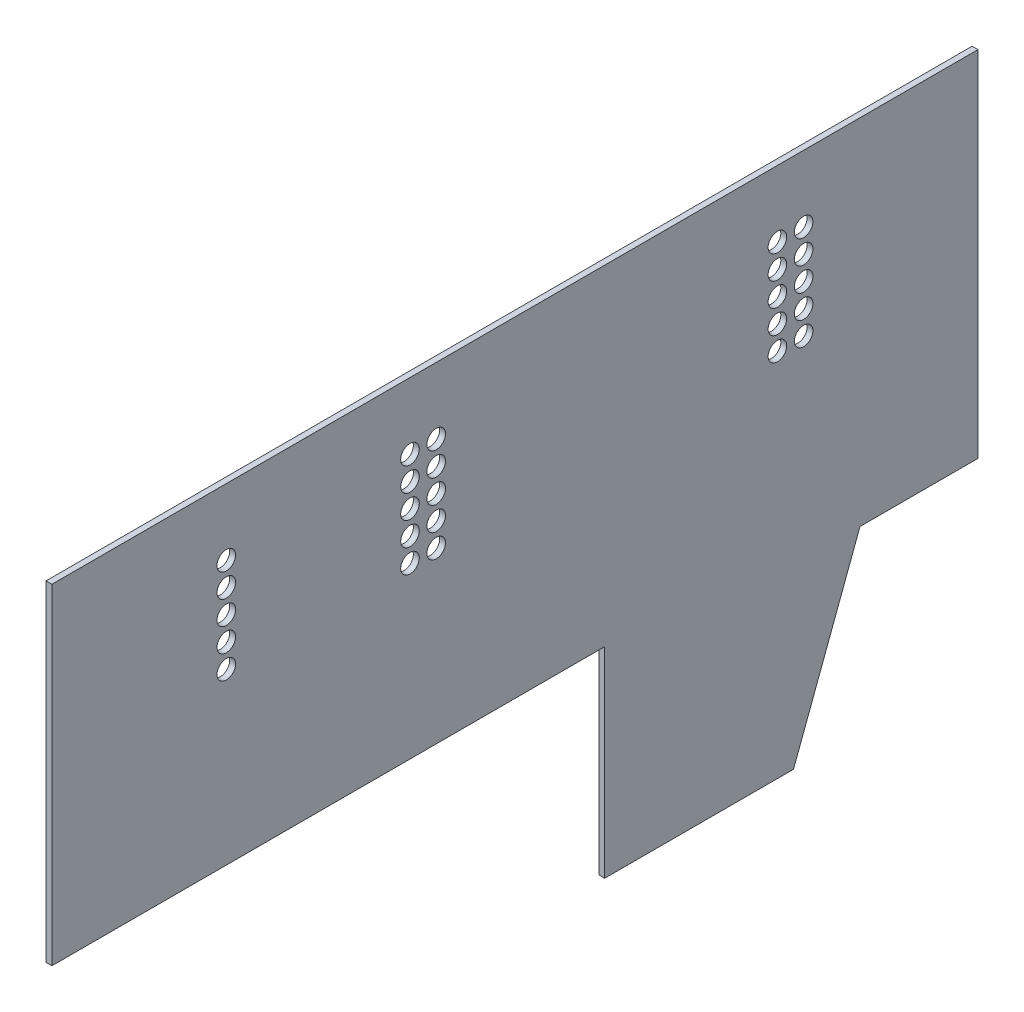
from build123d import *

# Parameters (mm, degrees)
SKETCH1_W                 = 498.348
SKETCH1_H                 = 177.8
BOSS_EXTRUDE1_DEPTH       = 1.5875
BOSS_EXTRUDE2_DEPTH       = 3.175
SKETCH3_R                 = 5
CUT_EXTRUDE1_DEPTH        = 318.565245896
LPATTERN3_COUNT           = 3
LPATTERN3_PITCH           = 12.7
LPATTERN3_COL_COUNT       = 3
LPATTERN3_COL_PITCH       = 12.7
LPATTERN1_COUNT           = 2
LPATTERN1_PITCH           = 197.7136
LPATTERN1_COPY_1_SKETCH_R = 5
LPATTERN1_COPY_1_DEPTH    = 318.565245896
LPATTERN1_COPY_2_SKETCH_R = 5
LPATTERN1_COPY_2_DEPTH    = 318.565245896
LPATTERN1_COPY_3_SKETCH_R = 5
LPATTERN1_COPY_3_DEPTH    = 318.565245896
LPATTERN1_COPY_4_SKETCH_R = 5
LPATTERN1_COPY_4_DEPTH    = 318.565245896
SKETCH4_R                 = 5
CUT_EXTRUDE2_DEPTH        = 318.565245896
LPATTERN4_COUNT           = 3
LPATTERN4_PITCH           = 12.7
LPATTERN4_COL_COUNT       = 3
LPATTERN4_COL_PITCH       = 12.7
LPATTERN5_COUNT           = 4
LPATTERN5_PITCH           = 98.8568
LPATTERN5_COPY_1_SKETCH_R = 5
LPATTERN5_COPY_1_DEPTH    = 318.565245896
LPATTERN5_COPY_2_SKETCH_R = 5
LPATTERN5_COPY_2_DEPTH    = 318.565245896
LPATTERN5_COPY_3_SKETCH_R = 5
LPATTERN5_COPY_3_DEPTH    = 318.565245896
LPATTERN5_COPY_4_SKETCH_R = 5
LPATTERN5_COPY_4_DEPTH    = 318.565245896
LPATTERN5_COPY_5_SKETCH_R = 5
LPATTERN5_COPY_5_DEPTH    = 318.565245896
LPATTERN5_COPY_6_SKETCH_R = 5
LPATTERN5_COPY_6_DEPTH    = 318.565245896
LPATTERN5_COPY_7_SKETCH_R = 5
LPATTERN5_COPY_7_DEPTH    = 318.565245896
LPATTERN5_COPY_8_SKETCH_R = 5
LPATTERN5_COPY_8_DEPTH    = 318.565245896


with BuildPart() as part:
    # Sketch1 → Boss-Extrude1 (new, symmetric)
    with BuildSketch(Plane(origin=(0, 0, 0), x_dir=(0, 0, -1), z_dir=(1, 0, 0))):
        Rectangle(SKETCH1_W, SKETCH1_H)
    extrude(amount=BOSS_EXTRUDE1_DEPTH, both=True)

    # Sketch2 → Boss-Extrude2 (add)
    with BuildSketch(Plane(origin=(1.5875, 0, 0), x_dir=(0, 0, -1), z_dir=(1, 0, 0))):
        Polygon((249.174, -88.9), (48.2854, -88.9), (48.2854, -196.85), (149.8854, -196.85), (185.674, -101.6), (249.174, -101.6), align=None)
    extrude(amount=-BOSS_EXTRUDE2_DEPTH)

    # Sketch3 → Cut-Extrude1 (cut, through all)
    with BuildSketch(Plane(origin=(1.5875, 0, 0), x_dir=(0, 0, -1), z_dir=(1, 0, 0))):
        with Locations((155.3337, 27.7749)):
            Circle(SKETCH3_R)
    cut_extrude1 = extrude(amount=-CUT_EXTRUDE1_DEPTH, mode=Mode.SUBTRACT)

    # LPattern3: Cut-Extrude1 ×3
    with Locations(*[(0, i * LPATTERN3_PITCH, 0) for i in range(1, LPATTERN3_COUNT)]):
        add(cut_extrude1, mode=Mode.SUBTRACT)

    # LPattern3 col: Cut-Extrude1 ×3
    with Locations(*[(0, -i * LPATTERN3_COL_PITCH, 0) for i in range(1, LPATTERN3_COL_COUNT)]):
        add(cut_extrude1, mode=Mode.SUBTRACT)

    # LPattern1: Cut-Extrude1 ×2
    with Locations(*[(0, 0, i * LPATTERN1_PITCH) for i in range(1, LPATTERN1_COUNT)]):
        add(cut_extrude1, mode=Mode.SUBTRACT)

    # LPattern1 copy 1 sketch → LPattern1 copy 1 (cut, through all)
    with BuildSketch(Plane(origin=(1.5875, 12.7, 197.7136), x_dir=(0, 0, -1), z_dir=(1, 0, 0))):
        with Locations((155.3337, 27.7749)):
            Circle(LPATTERN1_COPY_1_SKETCH_R)
    extrude(amount=-LPATTERN1_COPY_1_DEPTH, mode=Mode.SUBTRACT)

    # LPattern1 copy 2 sketch → LPattern1 copy 2 (cut, through all)
    with BuildSketch(Plane(origin=(1.5875, 25.4, 197.7136), x_dir=(0, 0, -1), z_dir=(1, 0, 0))):
        with Locations((155.3337, 27.7749)):
            Circle(LPATTERN1_COPY_2_SKETCH_R)
    extrude(amount=-LPATTERN1_COPY_2_DEPTH, mode=Mode.SUBTRACT)

    # LPattern1 copy 3 sketch → LPattern1 copy 3 (cut, through all)
    with BuildSketch(Plane(origin=(1.5875, -12.7, 197.7136), x_dir=(0, 0, -1), z_dir=(1, 0, 0))):
        with Locations((155.3337, 27.7749)):
            Circle(LPATTERN1_COPY_3_SKETCH_R)
    extrude(amount=-LPATTERN1_COPY_3_DEPTH, mode=Mode.SUBTRACT)

    # LPattern1 copy 4 sketch → LPattern1 copy 4 (cut, through all)
    with BuildSketch(Plane(origin=(1.5875, -25.4, 197.7136), x_dir=(0, 0, -1), z_dir=(1, 0, 0))):
        with Locations((155.3337, 27.7749)):
            Circle(LPATTERN1_COPY_4_SKETCH_R)
    extrude(amount=-LPATTERN1_COPY_4_DEPTH, mode=Mode.SUBTRACT)

    # Sketch4 → Cut-Extrude2 (cut, through all)
    with BuildSketch(Plane(origin=(1.5875, 0, 0), x_dir=(0, 0, -1), z_dir=(1, 0, 0))):
        with Locations((141.2367, 27.7749)):
            Circle(SKETCH4_R)
    cut_extrude2 = extrude(amount=-CUT_EXTRUDE2_DEPTH, mode=Mode.SUBTRACT)

    # LPattern4: Cut-Extrude2 ×3
    with Locations(*[(0, i * LPATTERN4_PITCH, 0) for i in range(1, LPATTERN4_COUNT)]):
        add(cut_extrude2, mode=Mode.SUBTRACT)

    # LPattern4 col: Cut-Extrude2 ×3
    with Locations(*[(0, -i * LPATTERN4_COL_PITCH, 0) for i in range(1, LPATTERN4_COL_COUNT)]):
        add(cut_extrude2, mode=Mode.SUBTRACT)

    # LPattern5: Cut-Extrude2 ×4, 1 skipped
    with Locations(*[(0, 0, i * LPATTERN5_PITCH) for i in range(1, LPATTERN5_COUNT) if i not in (1,)]):
        add(cut_extrude2, mode=Mode.SUBTRACT)

    # LPattern5 copy 1 sketch → LPattern5 copy 1 (cut, through all)
    with BuildSketch(Plane(origin=(1.5875, 12.7, 197.7136), x_dir=(0, 0, -1), z_dir=(1, 0, 0))):
        with Locations((141.2367, 27.7749)):
            Circle(LPATTERN5_COPY_1_SKETCH_R)
    extrude(amount=-LPATTERN5_COPY_1_DEPTH, mode=Mode.SUBTRACT)

    # LPattern5 copy 2 sketch → LPattern5 copy 2 (cut, through all)
    with BuildSketch(Plane(origin=(1.5875, 12.7, 296.5704), x_dir=(0, 0, -1), z_dir=(1, 0, 0))):
        with Locations((141.2367, 27.7749)):
            Circle(LPATTERN5_COPY_2_SKETCH_R)
    extrude(amount=-LPATTERN5_COPY_2_DEPTH, mode=Mode.SUBTRACT)

    # LPattern5 copy 3 sketch → LPattern5 copy 3 (cut, through all)
    with BuildSketch(Plane(origin=(1.5875, 25.4, 197.7136), x_dir=(0, 0, -1), z_dir=(1, 0, 0))):
        with Locations((141.2367, 27.7749)):
            Circle(LPATTERN5_COPY_3_SKETCH_R)
    extrude(amount=-LPATTERN5_COPY_3_DEPTH, mode=Mode.SUBTRACT)

    # LPattern5 copy 4 sketch → LPattern5 copy 4 (cut, through all)
    with BuildSketch(Plane(origin=(1.5875, 25.4, 296.5704), x_dir=(0, 0, -1), z_dir=(1, 0, 0))):
        with Locations((141.2367, 27.7749)):
            Circle(LPATTERN5_COPY_4_SKETCH_R)
    extrude(amount=-LPATTERN5_COPY_4_DEPTH, mode=Mode.SUBTRACT)

    # LPattern5 copy 5 sketch → LPattern5 copy 5 (cut, through all)
    with BuildSketch(Plane(origin=(1.5875, -12.7, 197.7136), x_dir=(0, 0, -1), z_dir=(1, 0, 0))):
        with Locations((141.2367, 27.7749)):
            Circle(LPATTERN5_COPY_5_SKETCH_R)
    extrude(amount=-LPATTERN5_COPY_5_DEPTH, mode=Mode.SUBTRACT)

    # LPattern5 copy 6 sketch → LPattern5 copy 6 (cut, through all)
    with BuildSketch(Plane(origin=(1.5875, -12.7, 296.5704), x_dir=(0, 0, -1), z_dir=(1, 0, 0))):
        with Locations((141.2367, 27.7749)):
            Circle(LPATTERN5_COPY_6_SKETCH_R)
    extrude(amount=-LPATTERN5_COPY_6_DEPTH, mode=Mode.SUBTRACT)

    # LPattern5 copy 7 sketch → LPattern5 copy 7 (cut, through all)
    with BuildSketch(Plane(origin=(1.5875, -25.4, 197.7136), x_dir=(0, 0, -1), z_dir=(1, 0, 0))):
        with Locations((141.2367, 27.7749)):
            Circle(LPATTERN5_COPY_7_SKETCH_R)
    extrude(amount=-LPATTERN5_COPY_7_DEPTH, mode=Mode.SUBTRACT)

    # LPattern5 copy 8 sketch → LPattern5 copy 8 (cut, through all)
    with BuildSketch(Plane(origin=(1.5875, -25.4, 296.5704), x_dir=(0, 0, -1), z_dir=(1, 0, 0))):
        with Locations((141.2367, 27.7749)):
            Circle(LPATTERN5_COPY_8_SKETCH_R)
    extrude(amount=-LPATTERN5_COPY_8_DEPTH, mode=Mode.SUBTRACT)


solid = part.part
